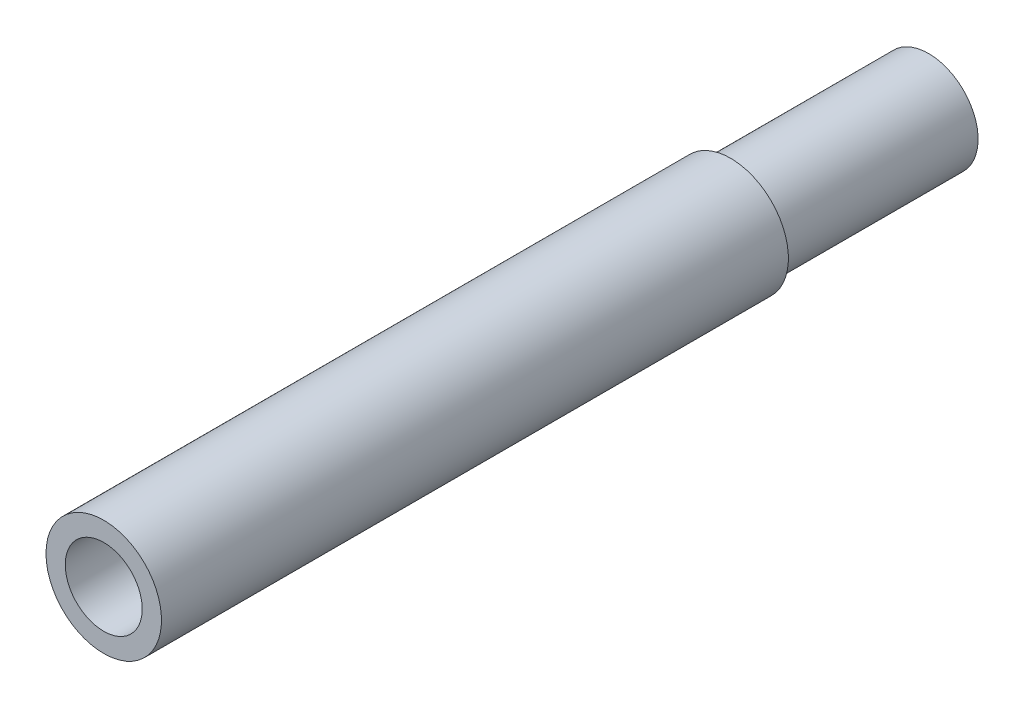
from build123d import *

# Parameters (mm, degrees)
SKETCH2_R           = 10.5
SKETCH2_R_2         = 7
BOSS_EXTRUDE1_DEPTH = 114
BOSS_EXTRUDE2_START = 36
SKETCH4_R           = 9
SKETCH4_R_2         = 7
BOSS_EXTRUDE2_DEPTH = 36


with BuildPart() as part:
    # Sketch2 → Boss-Extrude1 (new body)
    with BuildSketch(Plane.XY):
        with Locations(Location((0, 0, 0), (0, 0, 180))):
            Circle(SKETCH2_R)
        with Locations(Location((0, 0, 0), (0, 0, 180))):
            Circle(SKETCH2_R_2, mode=Mode.SUBTRACT)
    extrude(amount=BOSS_EXTRUDE1_DEPTH)

    # Sketch4 → Boss-Extrude2 (add)
    with BuildSketch(Plane(origin=(0, 0, 0), x_dir=(-1, 0, 0), z_dir=(0, 0, -1)).offset(BOSS_EXTRUDE2_START)):
        Circle(SKETCH4_R)
        Circle(SKETCH4_R_2, mode=Mode.SUBTRACT)
    extrude(amount=-BOSS_EXTRUDE2_DEPTH)


solid = part.part
